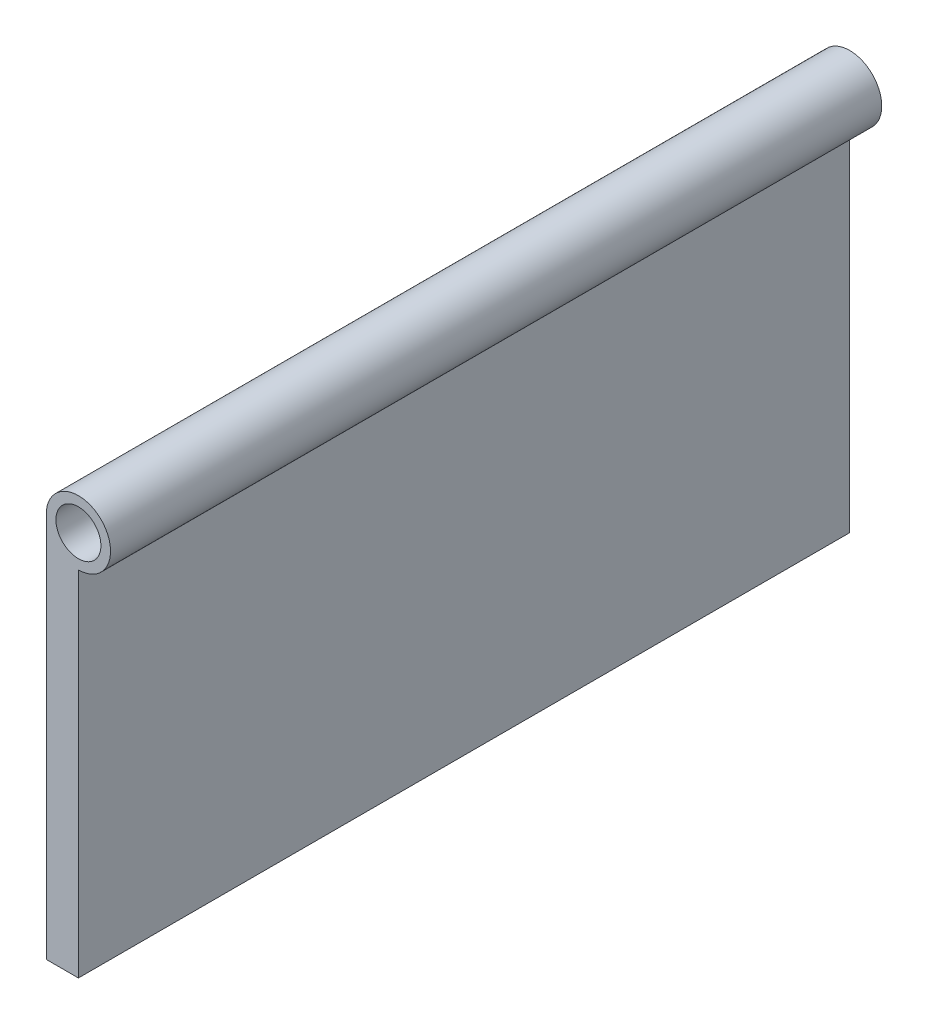
from build123d import *

# Parameters (mm, degrees)
SKETCH_1_W          = 5
SKETCH_1_H          = 60
EXTRUDE_1_DEPTH     = 60
SKETCH_2_R          = 5
SKETCH_3_R          = 3.5
CUT_EXTRUDE_4_DEPTH = 137.839321834


with BuildPart() as part:
    # Эскиз1 → Вытянуть-Тонкостенный1 (new, symmetric)
    with BuildSketch(Plane.XY):
        with Locations((2.5, 30)):
            Rectangle(SKETCH_1_W, SKETCH_1_H)
    extrude(amount=EXTRUDE_1_DEPTH, both=True)

    # По траектории1: sweep along a curve in space
    with BuildLine() as sweep_1_path:
        Line((5, 60, 60), (5, 60, -60))
    # Эскиз2 → По траектории1 (sweep)
    with BuildSketch(Plane.XY.offset(60)):
        with Locations((5, 60)):
            Circle(SKETCH_2_R)
    sweep(path=sweep_1_path.line)

    # Эскиз3 → Вырез-Вытянуть4 (cut, through all)
    with BuildSketch(Plane.XY.offset(60)):
        with Locations((5, 60)):
            Circle(SKETCH_3_R)
    extrude(amount=-CUT_EXTRUDE_4_DEPTH, mode=Mode.SUBTRACT)


solid = part.part
